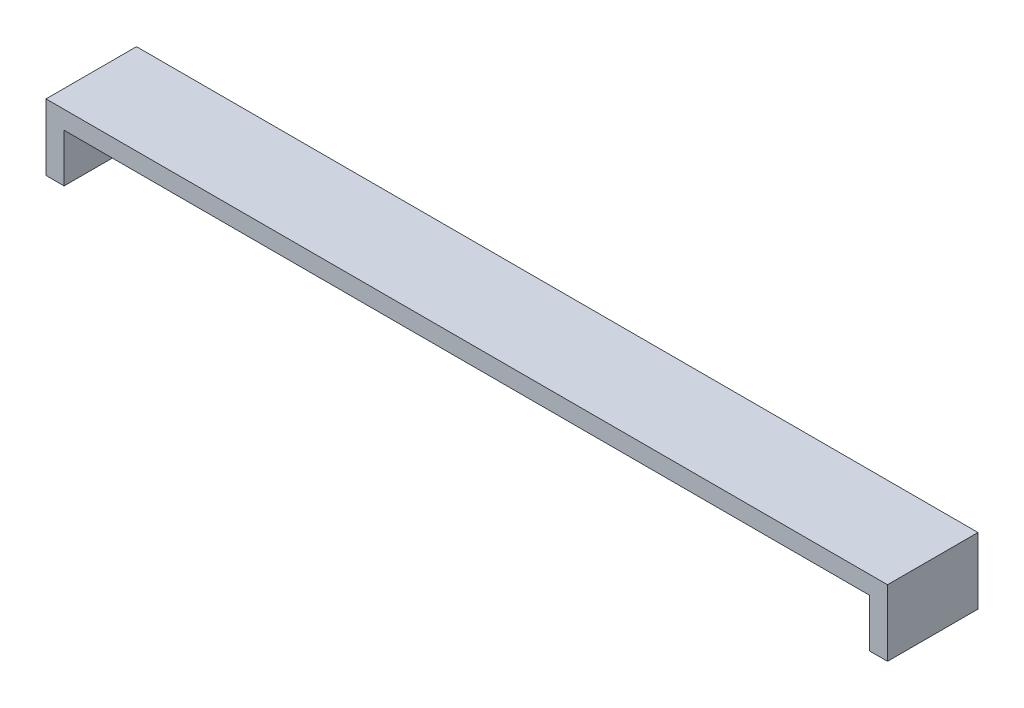
from build123d import *

# Parameters (mm, degrees)
BOSS_EXTRUDE1_DEPTH = 15


with BuildPart() as part:
    # Sketch1 → Boss-Extrude1 (new body)
    with BuildSketch(Plane.XY):
        Polygon((-66.75, -4), (-69.75, -4), (-69.75, 7), (69.75, 7), (69.75, -4), (66.75, -4), (66.75, 4), (-66.75, 4), align=None)
    extrude(amount=BOSS_EXTRUDE1_DEPTH)


solid = part.part
